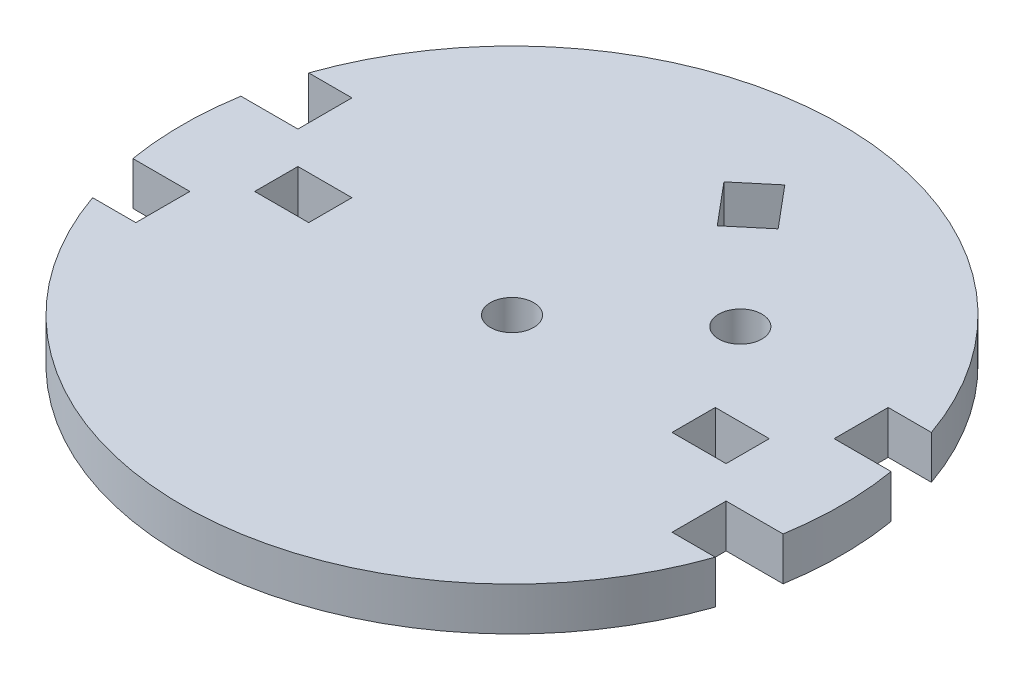
from build123d import *

# Parameters (mm, degrees)
CROQUIS1_R              = 30.5
SALIENTE_EXTRUIR1_DEPTH = 4
CROQUIS2_R              = 2
CORTAR_EXTRUIR1_DEPTH   = 4
CORTAR_EXTRUIR3_START   = -4
CORTAR_EXTRUIR3_DEPTH   = 4
CROQUIS6_W              = 5
CROQUIS6_H              = 4
CORTAR_EXTRUIR4_DEPTH   = 4
CROQUIS7_R              = 2
CORTAR_EXTRUIR5_DEPTH   = 4


with BuildPart() as part:
    # Croquis1 → Saliente-Extruir1 (new body)
    with BuildSketch(Plane(origin=(0, 0, 0), x_dir=(1, 0, 0), z_dir=(0, 1, 0))):
        with Locations(Location((0, 0, 0), (0, 0, 270))):
            Circle(CROQUIS1_R)
    extrude(amount=SALIENTE_EXTRUIR1_DEPTH)

    # Croquis2 → Cortar-Extruir1 (cut)
    with BuildSketch(Plane(origin=(0, 4, 0), x_dir=(1, 0, 0), z_dir=(0, 1, 0))):
        with Locations(Location((0, 0, 0), (0, 0, 270))):
            Circle(CROQUIS2_R)
    extrude(amount=-CORTAR_EXTRUIR1_DEPTH, mode=Mode.SUBTRACT)

    # Croquis5 → Cortar-Extruir3 (cut)
    with BuildSketch(Plane(origin=(0, 4, 0), x_dir=(1, 0, 0), z_dir=(0, 1, 0)).offset(CORTAR_EXTRUIR3_START)):
        with BuildLine():
            Line((28.814059068, 5), (30.087372767, 5))
            ThreePointArc((30.087372767, 5), (29.556634924, 7.526973624), (28.814059068, 10))
            Line((28.814059068, 10), (24.814059068, 10))
            Line((24.814059068, 10), (24.814059068, 5))
            Line((24.814059068, 5), (28.814059068, 5))
        make_face()
        with BuildLine():
            Line((30.087372767, -5), (28.814059068, -5))
            Line((28.814059068, -5), (24.814059068, -5))
            Line((24.814059068, -5), (24.814059068, -10))
            Line((24.814059068, -10), (28.814059068, -10))
            ThreePointArc((28.814059068, -10), (29.556634924, -7.526973624), (30.087372767, -5))
        make_face()
        with BuildLine():
            Line((-24.814059068, 5), (-24.814059068, 10))
            Line((-24.814059068, 10), (-28.814059068, 10))
            ThreePointArc((-28.814059068, 10), (-29.556634924, 7.526973624), (-30.087372767, 5))
            Line((-30.087372767, 5), (-28.814059068, 5))
            Line((-28.814059068, 5), (-24.814059068, 5))
        make_face()
        with BuildLine():
            Line((-28.814059068, -10), (-24.814059068, -10))
            Line((-24.814059068, -10), (-24.814059068, -5))
            Line((-24.814059068, -5), (-28.814059068, -5))
            Line((-28.814059068, -5), (-30.087372767, -5))
            ThreePointArc((-30.087372767, -5), (-29.556634924, -7.526973624), (-28.814059068, -10))
        make_face()
    extrude(amount=CORTAR_EXTRUIR3_DEPTH, mode=Mode.SUBTRACT)

    # Croquis6 → Cortar-Extruir4 (cut)
    with BuildSketch(Plane(origin=(0, 4, 0), x_dir=(1, 0, 0), z_dir=(0, 1, 0))):
        with Locations((-19.314059068, 0)):
            Rectangle(CROQUIS6_W, CROQUIS6_H)
        with Locations((19.314059068, 0)):
            Rectangle(CROQUIS6_W, CROQUIS6_H)
    extrude(amount=-CORTAR_EXTRUIR4_DEPTH, mode=Mode.SUBTRACT)

    # Croquis7 → Cortar-Extruir5 (cut)
    with BuildSketch(Plane(origin=(0, 4, 0), x_dir=(1, 0, 0), z_dir=(0, 1, 0))):
        with Locations(Location((11.490666647, 9.641814145, 0), (0, 0, 270))):
            Circle(CROQUIS7_R)
        Polygon((2.194434654, 23.054217761), (-0.869743118, 20.483067322), (2.34419493, 16.652845106), (5.408372702, 19.223995545), align=None)
    extrude(amount=-CORTAR_EXTRUIR5_DEPTH, mode=Mode.SUBTRACT)


solid = part.part
